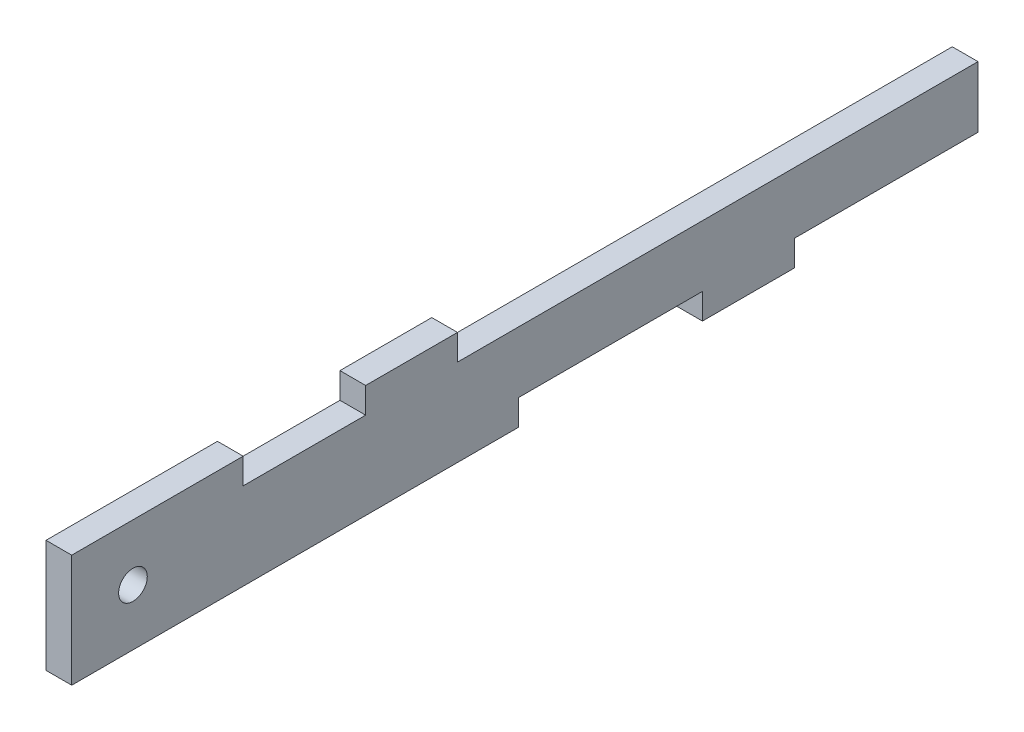
from build123d import *

# Parameters (mm, degrees)
SKETCH1_W   = 187.96
SKETCH1_H   = 23.368
BASE_DEPTH  = 5.334
SKETCH3_W   = 25.4
SKETCH3_H   = 5.334
SKETCH3_W_2 = 38.1
SKETCH3_W_3 = 107.95
TABS_DEPTH  = 190.482127337
SKETCH4_R   = 2.9718
AXLE_DEPTH  = 190.482127337


with BuildPart() as part:
    # Sketch1 → Base (new body)
    with BuildSketch(Plane(origin=(0, 0, 0), x_dir=(0, 0, -1), z_dir=(1, 0, 0))):
        with Locations((93.98, 11.684)):
            Rectangle(SKETCH1_W, SKETCH1_H)
    extrude(amount=BASE_DEPTH)

    # Sketch3 → Tabs (cut, through all)
    with BuildSketch(Plane(origin=(5.334, 0, 0), x_dir=(0, 0, -1), z_dir=(1, 0, 0))):
        with Locations((48.26, 20.701)):
            Rectangle(SKETCH3_W, SKETCH3_H)
        with Locations((111.76, 2.667)):
            Rectangle(SKETCH3_W_2, SKETCH3_H)
        with Locations((168.91, 2.667)):
            Rectangle(SKETCH3_W_2, SKETCH3_H)
        with Locations((133.985, 20.701)):
            Rectangle(SKETCH3_W_3, SKETCH3_H)
    extrude(amount=-TABS_DEPTH, mode=Mode.SUBTRACT)

    # Sketch4 → Axle (cut, through all)
    with BuildSketch(Plane(origin=(5.334, 0, 0), x_dir=(0, 0, -1), z_dir=(1, 0, 0))):
        with Locations((12.7, 11.684)):
            Circle(SKETCH4_R)
    extrude(amount=-AXLE_DEPTH, mode=Mode.SUBTRACT)


solid = part.part
